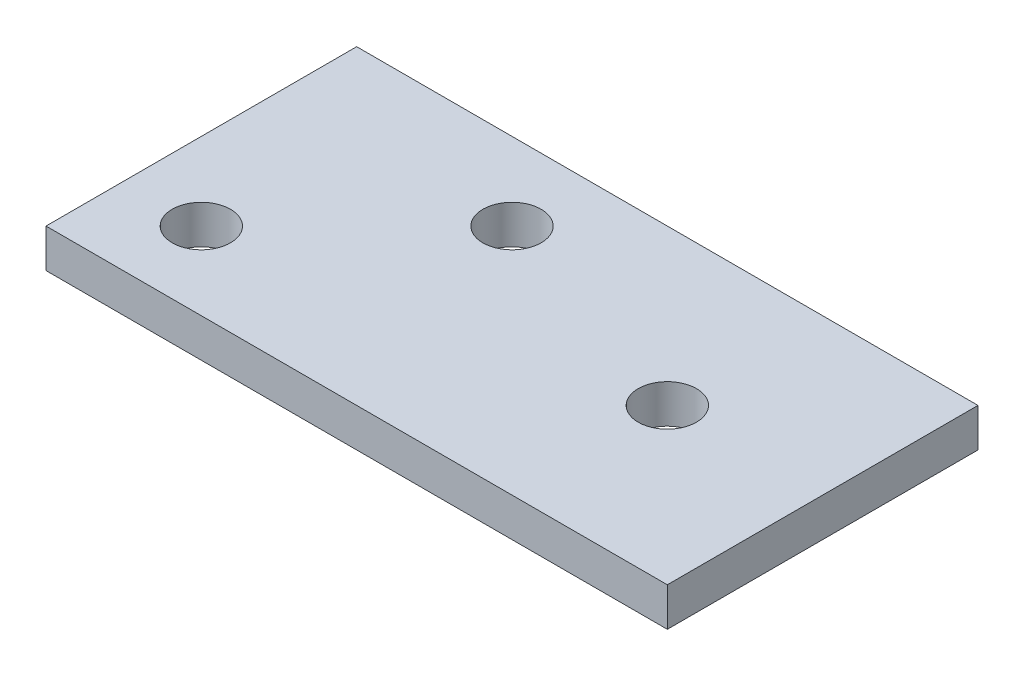
from build123d import *

# Parameters (mm, degrees)
CROQUIS1_W              = 101.6
CROQUIS1_H              = 50.8
SALIENTE_EXTRUIR1_DEPTH = 6.31
CROQUIS2_R              = 4.7625
CORTAR_EXTRUIR1_DEPTH   = 6.31
CROQUIS3_R              = 4.7625
CORTAR_EXTRUIR2_DEPTH   = 10


with BuildPart() as part:
    # Croquis1 → Saliente-Extruir1 (new body)
    with BuildSketch(Plane(origin=(0, 0, 0), x_dir=(1, 0, 0), z_dir=(0, 1, 0))):
        Rectangle(CROQUIS1_W, CROQUIS1_H)
    extrude(amount=SALIENTE_EXTRUIR1_DEPTH)

    # Croquis2 → Cortar-Extruir1 (cut)
    with BuildSketch(Plane(origin=(0, 6.31, 0), x_dir=(1, 0, 0), z_dir=(0, 1, 0))):
        with Locations(Location((-38.1, -12.7, 0), (0, 0, 270))):
            Circle(CROQUIS2_R)
        with Locations(Location((-12.7, 12.7, 0), (0, 0, 270))):
            Circle(CROQUIS2_R)
    extrude(amount=-CORTAR_EXTRUIR1_DEPTH, mode=Mode.SUBTRACT)

    # Croquis3 → Cortar-Extruir2 (cut)
    with BuildSketch(Plane(origin=(0, 6.31, 0), x_dir=(1, 0, 0), z_dir=(0, 1, 0))):
        with Locations(Location((25.4, 0, 0), (0, 0, 270))):
            Circle(CROQUIS3_R)
    extrude(amount=-CORTAR_EXTRUIR2_DEPTH, mode=Mode.SUBTRACT)


solid = part.part
